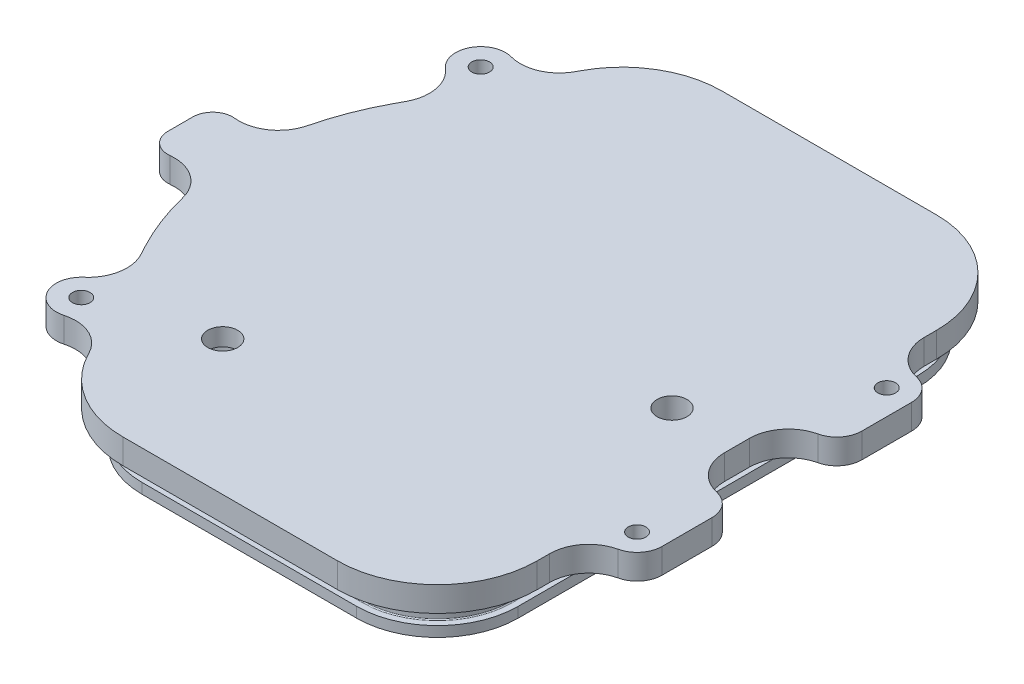
from build123d import *

# Parameters (mm, degrees)
BOSS_EXTRUDE1_DEPTH   = 6.35
BOSS_EXTRUDE2_DEPTH   = 8.7122
CUT_EXTRUDE1_START    = 2.54
SKETCH3_W             = 165.1
SKETCH3_H             = 165.1
CUT_EXTRUDE1_DEPTH    = 3.556
SKETCH4_R             = 25.4
SKETCH4_R_2           = 19.05
BOSS_EXTRUDE3_DEPTH   = 8.7122
HOLE1_D               = 7.62
CUT_EXTRUDE2_DEPTH    = 10.6172
HOLE2_D               = 7.62
BOSS_EXTRUDE4_START   = 10.6172
BOSS_EXTRUDE4_DEPTH   = 10.6172
FILLET4_R             = 6.604
FILLET5_R             = 7.62
BOSS_EXTRUDE5_DEPTH   = 6.35
FILLET6_R             = 9.144
CHAMFER2_SIZE         = 1.016
FILLET7_R             = 0.254
F_8_CLEARANCE_HOLE1_D = 4.4958


with BuildPart() as part:
    # Sketch1 → Boss-Extrude1 (new body)
    with BuildSketch(Plane(origin=(0, 0, 0), x_dir=(1, 0, 0), z_dir=(0, 1, 0))):
        with BuildLine():
            Line((-10.16, -76.2), (44.45, -76.2))
            ThreePointArc((44.45, -76.2), (62.410512242, -68.760512242), (69.85, -50.8))
            Line((69.85, -50.8), (69.85, 50.8))
            ThreePointArc((69.85, 50.8), (62.410512242, 68.760512242), (44.45, 76.2))
            Line((44.45, 76.2), (-10.16, 76.2))
            ThreePointArc((-10.16, 76.2), (-23.228192188, 72.580320313), (-32.571764706, 62.752941176))
            Line((-32.571764706, 62.752941176), (-49.305882353, 31.376470588))
            ThreePointArc((-49.305882353, 31.376470588), (-57.15, 0), (-49.305882353, -31.376470588))
            Line((-49.305882353, -31.376470588), (-32.571764706, -62.752941176))
            ThreePointArc((-32.571764706, -62.752941176), (-23.228192188, -72.580320313), (-10.16, -76.2))
        make_face()
    extrude(amount=BOSS_EXTRUDE1_DEPTH)

    # Sketch2 → Boss-Extrude2 (add)
    with BuildSketch(Plane.XZ):
        with BuildLine():
            Line((-28.291117647, 60.469929412), (-45.025235294, 29.093458824))
            ThreePointArc((-45.025235294, 29.093458824), (-52.2986, 0), (-45.025235294, -29.093458824))
            Line((-45.025235294, -29.093458824), (-28.291117647, -60.469929412))
            ThreePointArc((-28.291117647, -60.469929412), (-20.73216748, -68.420279133), (-10.16, -71.3486))
            Line((-10.16, -71.3486), (44.45, -71.3486))
            ThreePointArc((44.45, -71.3486), (58.980054404, -65.330054404), (64.9986, -50.8))
            Line((64.9986, -50.8), (64.9986, 50.8))
            ThreePointArc((64.9986, 50.8), (58.980054404, 65.330054404), (44.45, 71.3486))
            Line((44.45, 71.3486), (-10.16, 71.3486))
            ThreePointArc((-10.16, 71.3486), (-20.73216748, 68.420279133), (-28.291117647, 60.469929412))
        make_face()
    extrude(amount=BOSS_EXTRUDE2_DEPTH)

    # Sketch3 → Cut-Extrude1 (cut)
    with BuildSketch(Plane.XZ.offset(CUT_EXTRUDE1_START)):
        Rectangle(SKETCH3_W, SKETCH3_H)
        with BuildLine():
            Line((-26.722294118, 59.633223529), (-43.456411765, 28.256752941))
            ThreePointArc((-43.456411765, 28.256752941), (-50.5206, 0), (-43.456411765, -28.256752941))
            Line((-43.456411765, -28.256752941), (-26.722294118, -59.633223529))
            ThreePointArc((-26.722294118, -59.633223529), (-19.817394027, -66.895656711), (-10.16, -69.5706))
            Line((-10.16, -69.5706), (44.45, -69.5706))
            ThreePointArc((44.45, -69.5706), (57.722818547, -64.072818547), (63.2206, -50.8))
            Line((63.2206, -50.8), (63.2206, 50.8))
            ThreePointArc((63.2206, 50.8), (57.722818547, 64.072818547), (44.45, 69.5706))
            Line((44.45, 69.5706), (-10.16, 69.5706))
            ThreePointArc((-10.16, 69.5706), (-19.817394027, 66.895656711), (-26.722294118, 59.633223529))
        make_face(mode=Mode.SUBTRACT)
    extrude(amount=CUT_EXTRUDE1_DEPTH, mode=Mode.SUBTRACT)

    # Sketch4 → Boss-Extrude3 (add)
    with BuildSketch(Plane.XZ):
        Circle(SKETCH4_R)
        Circle(SKETCH4_R_2, mode=Mode.SUBTRACT)
    extrude(amount=BOSS_EXTRUDE3_DEPTH)

    # Hole1 (through all)
    with Locations(Plane.XZ.offset(8.7122)):
        with Locations((53.34, 0)):
            Hole(HOLE1_D / 2)

    # Sketch7 → Cut-Extrude2 (cut)
    with BuildSketch(Plane.XZ.offset(8.7122)):
        with BuildLine():
            Line((58.6486, 8.662815134), (58.6486, 50.8))
            ThreePointArc((58.6486, 50.8), (54.489926343, 60.839926343), (44.45, 64.9986))
            Line((44.45, 64.9986), (-10.16, 64.9986))
            ThreePointArc((-10.16, 64.9986), (-17.465119433, 62.975199055), (-22.688176471, 57.481694118))
            Line((-22.688176471, 57.481694118), (-39.422294118, 26.105223529))
            ThreePointArc((-39.422294118, 26.105223529), (-45.9486, 0), (-39.422294118, -26.105223529))
            Line((-39.422294118, -26.105223529), (-22.688176471, -57.481694118))
            ThreePointArc((-22.688176471, -57.481694118), (-17.465119433, -62.975199055), (-10.16, -64.9986))
            Line((-10.16, -64.9986), (44.45, -64.9986))
            ThreePointArc((44.45, -64.9986), (54.489926343, -60.839926343), (58.6486, -50.8))
            Line((58.6486, -50.8), (58.6486, -8.662815134))
            ThreePointArc((58.6486, -8.662815134), (43.18, 0), (58.6486, 8.662815134))
        make_face()
    extrude(amount=-CUT_EXTRUDE2_DEPTH, mode=Mode.SUBTRACT)

    # Hole2 (through all)
    with Locations(Plane.XZ.offset(-1.905)):
        with Locations((-19.05, 41.91)):
            Hole(HOLE2_D / 2)

    # Sketch11 → Boss-Extrude4 (add)
    with BuildSketch(Plane.XZ.offset(-1.905).offset(BOSS_EXTRUDE4_START)):
        with BuildLine():
            Line((-10.16, 33.02), (-35.734413333, 33.02))
            Line((-35.734413333, 33.02), (-37.08908, 30.48))
            Line((-37.08908, 30.48), (-7.62, 30.48))
            Line((-7.62, 30.48), (-7.62, 64.9986))
            Line((-7.62, 64.9986), (-10.16, 64.9986))
            ThreePointArc((-10.16, 64.9986), (-16.993992609, 63.245753773), (-22.140644472, 58.42))
            Line((-22.140644472, 58.42), (-10.16, 58.42))
            Line((-10.16, 58.42), (-10.16, 33.02))
        make_face()
    extrude(amount=-BOSS_EXTRUDE4_DEPTH)

    # Fillet4
    fillet4_edges = [part.edges().sort_by_distance(p)[0] for p in [
        (-10.16, -3.4036, 58.42),
        (-10.16, -3.4036, 33.02),
        (-35.734413333, -3.4036, 33.02),
        (-22.140644472, -3.4036, 58.42),
    ]]
    fillet(fillet4_edges, radius=FILLET4_R)

    # Fillet5
    fillet5_edges = [part.edges().sort_by_distance(p)[0] for p in [
        (58.6486, -3.4036, -8.662815134),
        (58.6486, -3.4036, 8.662815134),
        (-37.08908, -3.4036, 30.48),
        (-7.62, -3.4036, 64.9986),
    ]]
    fillet(fillet5_edges, radius=FILLET5_R)

    # Sketch12 → Boss-Extrude5 (add)
    with BuildSketch(Plane.XZ):
        with BuildLine():
            Line((82.55, -19.05), (82.55, -31.75))
            ThreePointArc((82.55, -31.75), (81.15851694, -35.716813552), (77.593902439, -37.945121951))
            ThreePointArc((77.593902439, -37.945121951), (72.024192281, -41.426853825), (69.85, -47.625))
            Line((69.85, -47.625), (69.85, -3.175))
            ThreePointArc((69.85, -3.175), (72.024192281, -9.373146175), (77.593902439, -12.854878049))
            ThreePointArc((77.593902439, -12.854878049), (81.15851694, -15.083186448), (82.55, -19.05))
        make_face()
        with BuildLine():
            Line((69.85, 47.625), (69.85, 3.175))
            ThreePointArc((69.85, 3.175), (72.024192281, 9.373146175), (77.593902439, 12.854878049))
            ThreePointArc((77.593902439, 12.854878049), (81.15851694, 15.083186448), (82.55, 19.05))
            Line((82.55, 19.05), (82.55, 31.75))
            ThreePointArc((82.55, 31.75), (81.15851694, 35.716813552), (77.593902439, 37.945121951))
            ThreePointArc((77.593902439, 37.945121951), (72.024192281, 41.426853825), (69.85, 47.625))
        make_face()
        with BuildLine():
            Line((-33.069803922, -61.819117647), (-48.010980392, -33.804411765))
            ThreePointArc((-48.010980392, -33.804411765), (-47.012610676, -40.296513581), (-50.288598757, -45.989670014))
            ThreePointArc((-50.288598757, -45.989670014), (-51.74627451, -53.788235294), (-44.457895744, -56.922238164))
            ThreePointArc((-44.457895744, -56.922238164), (-37.904983546, -57.373314449), (-33.069803922, -61.819117647))
        make_face()
        with BuildLine():
            Line((-48.010980392, 33.804411765), (-33.069803922, 61.819117647))
            ThreePointArc((-33.069803922, 61.819117647), (-37.904983546, 57.373314449), (-44.457895744, 56.922238164))
            ThreePointArc((-44.457895744, 56.922238164), (-51.74627451, 53.788235294), (-50.288598757, 45.989670014))
            ThreePointArc((-50.288598757, 45.989670014), (-47.012610676, 40.296513581), (-48.010980392, 33.804411765))
        make_face()
        with BuildLine():
            Line((-71.755, 3.175), (-71.755, -3.175))
            ThreePointArc((-71.755, -3.175), (-70.070393099, -6.953585146), (-66.133856021, -8.226095247))
            ThreePointArc((-66.133856021, -8.226095247), (-59.2468111, -10.003386683), (-55.232547823, -15.875))
            ThreePointArc((-55.232547823, -15.875), (-57.15, 0), (-55.232547823, 15.875))
            ThreePointArc((-55.232547823, 15.875), (-59.2468111, 10.003386683), (-66.133856021, 8.226095247))
            ThreePointArc((-66.133856021, 8.226095247), (-70.070393099, 6.953585146), (-71.755, 3.175))
        make_face()
    extrude(amount=-BOSS_EXTRUDE5_DEPTH)

    # Fillet6
    fillet6_edges = [part.edges().sort_by_distance(p)[0] for p in [
        (-7.62, -3.4036, 30.48),
    ]]
    fillet(fillet6_edges, radius=FILLET6_R)

    # Chamfer2
    chamfer2_edges = [part.edges().sort_by_distance(p)[0] for p in [
        (54.489926343, -8.7122, 60.839926343),
        (22.225, -8.7122, 64.9986),
        (-45.9486, -8.7122, 0),
        (-31.055235294, -8.7122, -41.793458824),
        (-17.465119433, -8.7122, -62.975199055),
        (17.145, -8.7122, -64.9986),
        (54.489926343, -8.7122, -60.839926343),
        (58.6486, -8.7122, -34.214559405),
        (-17.494673333, -8.7122, 58.42),
        (-27.30360549, -8.7122, 48.827764706),
        (-20.745873333, -8.7122, 33.02),
        (-10.16, -8.7122, 45.72),
        (-21.623076636, -8.7122, 57.478883281),
        (-12.094266817, -8.7122, 34.954266817),
        (-30.390629948, -8.7122, 36.226270031),
        (-12.094266817, -8.7122, 56.485733183),
        (43.18, -8.7122, 0),
        (58.6486, -8.7122, 34.214559405),
        (-24.64054, -8.7122, 30.48),
        (-39.331451765, -8.7122, 26.275552941),
        (56.75628592, -8.7122, -12.603383641),
        (56.75628592, -8.7122, 12.603383641),
        (-5.388153673, -8.7122, 62.766753673),
        (-36.437537656, -8.7122, 29.394096094),
        (-7.62, -8.7122, 48.5013),
        (-10.298215593, -8.7122, 33.158215593),
    ]]
    chamfer(chamfer2_edges, length=CHAMFER2_SIZE)

    # Fillet7
    fillet7_edges = [part.edges().sort_by_distance(p)[0] for p in [
        (17.145, -2.54, 69.5706),
        (-19.817394027, -2.54, 66.895656711),
        (-35.089352941, -2.54, 43.944988235),
        (-50.5206, -2.54, 0),
        (-35.089352941, -2.54, -43.944988235),
        (-19.817394027, -2.54, -66.895656711),
        (17.145, -2.54, -69.5706),
        (57.722818547, -2.54, -64.072818547),
        (63.2206, -2.54, 0),
        (57.722818547, -2.54, 64.072818547),
        (-19.817394027, -6.096, 66.895656711),
        (-35.089352941, -6.096, 43.944988235),
        (-50.5206, -6.096, 0),
        (-35.089352941, -6.096, -43.944988235),
        (-19.817394027, -6.096, -66.895656711),
        (17.145, -6.096, -69.5706),
        (57.722818547, -6.096, -64.072818547),
        (63.2206, -6.096, 0),
        (57.722818547, -6.096, 64.072818547),
        (17.145, -6.096, 69.5706),
    ]]
    fillet(fillet7_edges, radius=FILLET7_R)

    # #8 Clearance Hole1 (through all)
    with Locations(Plane(origin=(0, 6.35, 0), x_dir=(-1, 0, 0), z_dir=(0, 1, 0))):
        with Locations((46.143333333, 50.8), (46.143333333, -50.8), (-76.2, -31.75), (-76.2, 31.75)):
            Hole(F_8_CLEARANCE_HOLE1_D / 2)


solid = part.part
